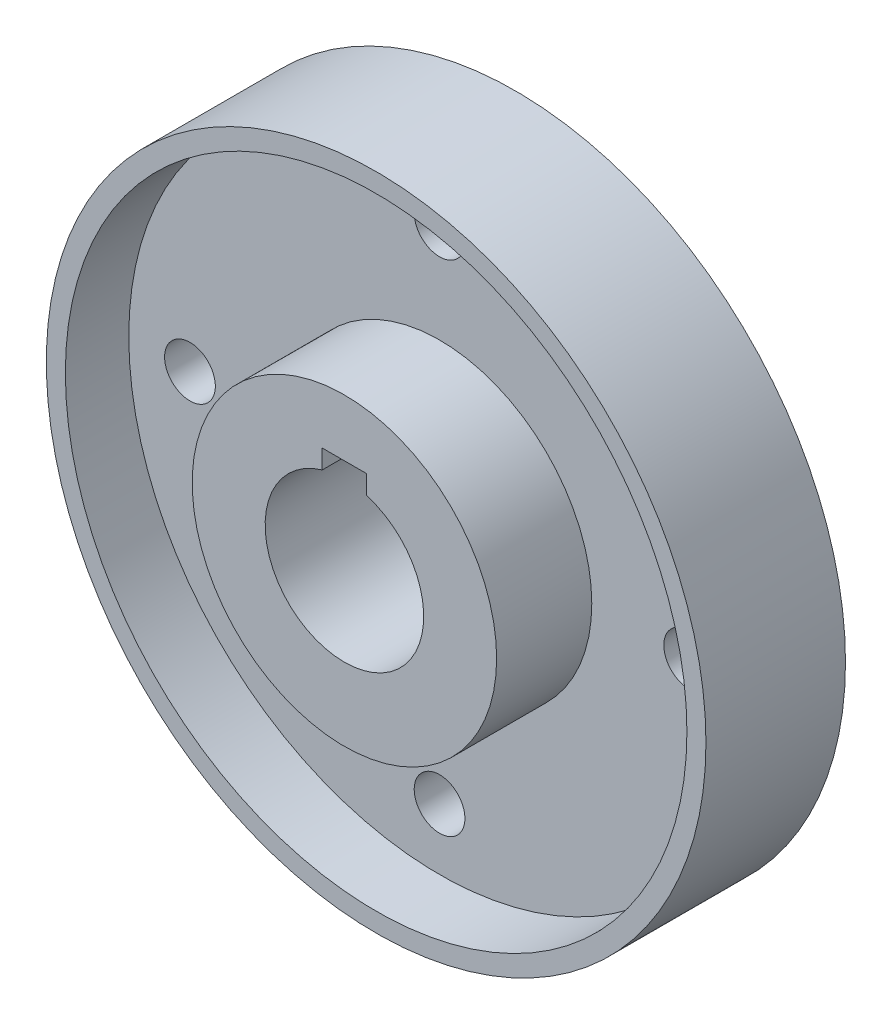
from build123d import *

# Parameters (mm, degrees)
SKETCH2_W          = 14
SKETCH2_H          = 10
CUT_EXTRUDE1_DEPTH = 146
SKETCH3_R          = 8
CUT_EXTRUDE2_DEPTH = 217
CIRPATTERN1_COUNT  = 4


with BuildPart() as part:
    # Sketch1 → Revolve1 (revolve)
    with BuildSketch(Plane(origin=(0, 0, 0), x_dir=(0, 0, -1), z_dir=(1, 0, 0)), mode=Mode.PRIVATE) as revolve1_sk:
        Polygon((-44, 104), (0, 104), (0, 48), (-5, 48), (-5, 25), (-54, 25), (-54, 48), (-24, 48), (-24, 98), (-44, 98), align=None)
    revolve(revolve1_sk.sketch.rotate(Axis((0, 0, 52.496471852), (0, 0, -1)), 90), axis=Axis((0, 0, 52.496471852), (0, 0, -1)))

    # Sketch2 → Cut-Extrude1 (cut)
    with BuildSketch(Plane.XY):
        with Locations((0, 25)):
            Rectangle(SKETCH2_W, SKETCH2_H)
    extrude(amount=CUT_EXTRUDE1_DEPTH, mode=Mode.SUBTRACT)

    # Sketch3 → Cut-Extrude2 (cut)
    with BuildSketch(Plane.XY):
        with Locations(Location((0, 78.704447468, 0), (0, 0, 180))):
            Circle(SKETCH3_R)
    cut_extrude2 = extrude(amount=CUT_EXTRUDE2_DEPTH, mode=Mode.SUBTRACT)

    # CirPattern1: Cut-Extrude2 ×4 about axis
    cirpattern1_axis = Axis((0, 0, 0), (0, 0, 1))
    for i in range(1, CIRPATTERN1_COUNT):
        add(cut_extrude2.rotate(cirpattern1_axis, i * 360 / CIRPATTERN1_COUNT), mode=Mode.SUBTRACT)


solid = part.part
